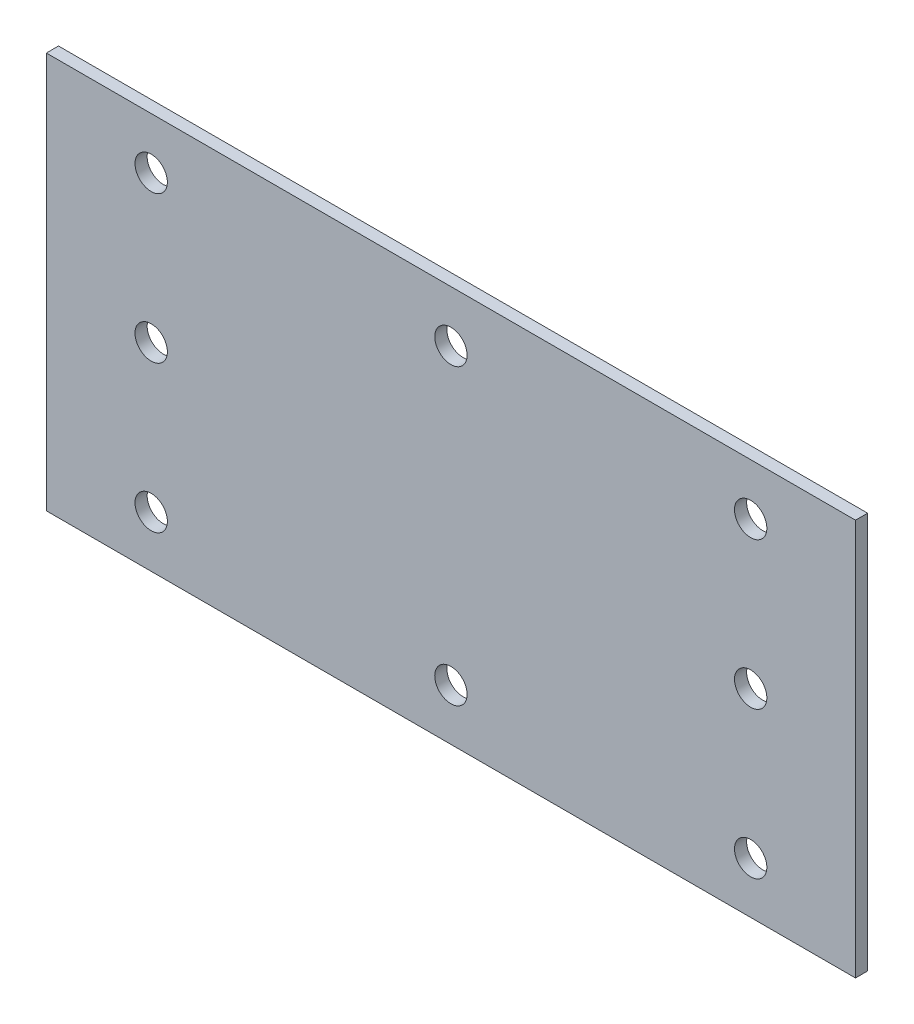
from build123d import *

# Parameters (mm, degrees)
SKETCH1_W           = 200
SKETCH1_H           = 98
SKETCH1_R           = 4
BOSS_EXTRUDE1_DEPTH = 3


with BuildPart() as part:
    # Sketch1 → Boss-Extrude1 (new body)
    with BuildSketch(Plane.XY):
        with Locations((-26.405797101, 15.623188406)):
            Rectangle(SKETCH1_W, SKETCH1_H)
        with Locations((47.680210455, 51.925332109)):
            Circle(SKETCH1_R, mode=Mode.SUBTRACT)
        with Locations(Location((-100.491804658, 51.925332109, 0), (0, 0, 180))):
            Circle(SKETCH1_R, mode=Mode.SUBTRACT)
        with Locations((-100.491804658, -20.678955297)):
            Circle(SKETCH1_R, mode=Mode.SUBTRACT)
        with Locations(Location((47.680210455, -20.678955297, 0), (0, 0, 180))):
            Circle(SKETCH1_R, mode=Mode.SUBTRACT)
        with Locations((-100.491804658, 15.623188406)):
            Circle(SKETCH1_R, mode=Mode.SUBTRACT)
        with Locations(Location((47.680210455, 15.623188406, 0), (0, 0, 180))):
            Circle(SKETCH1_R, mode=Mode.SUBTRACT)
        with Locations((-26.405797101, 51.925332109)):
            Circle(SKETCH1_R, mode=Mode.SUBTRACT)
        with Locations(Location((-26.405797101, -20.678955297, 0), (0, 0, 180))):
            Circle(SKETCH1_R, mode=Mode.SUBTRACT)
    extrude(amount=BOSS_EXTRUDE1_DEPTH)


solid = part.part
